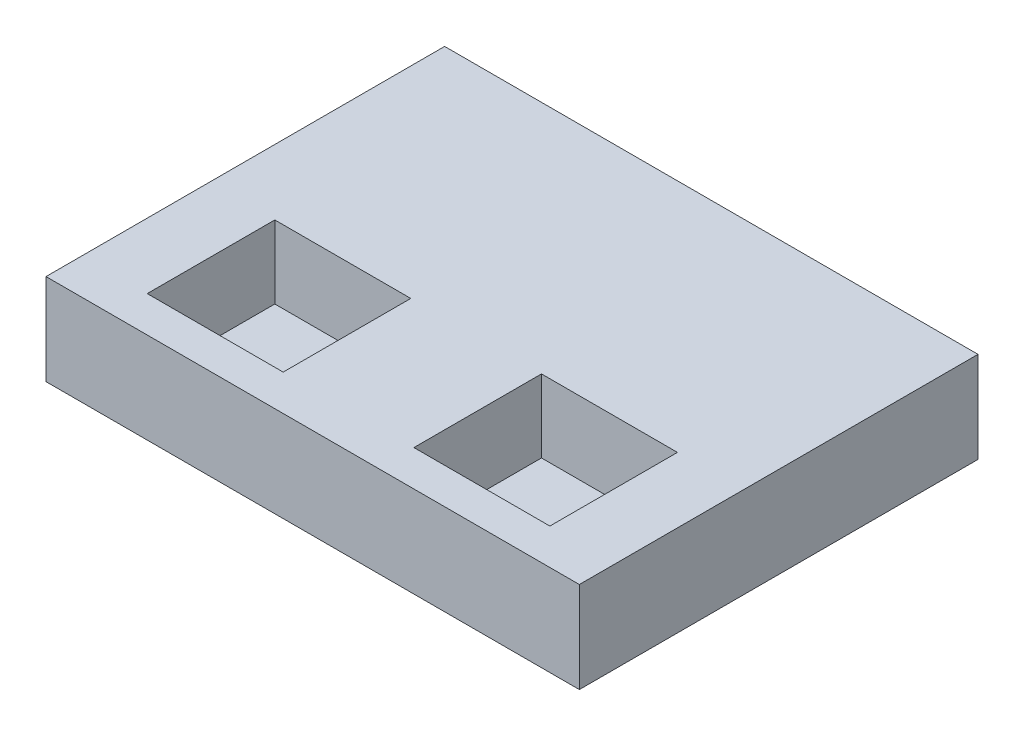
from build123d import *

# Parameters (mm, degrees)
SZKIC1_W                    = 293
SZKIC1_H                    = 219
DODANIE_WYCI_GNI_CIE1_DEPTH = 50
SZKIC2_W                    = 74.69112587
SZKIC2_H                    = 70.093493154
WYTNIJ_WYCI_GNI_CIE1_DEPTH  = 40


with BuildPart() as part:
    # Szkic1 → Dodanie-wyciągnięcie1 (new body)
    with BuildSketch(Plane(origin=(0, 0, 0), x_dir=(1, 0, 0), z_dir=(0, 1, 0))):
        Rectangle(SZKIC1_W, SZKIC1_H)
    extrude(amount=DODANIE_WYCI_GNI_CIE1_DEPTH)

    # Szkic2 → Wytnij-wyciągnięcie1 (cut)
    with BuildSketch(Plane(origin=(0, 50, 0), x_dir=(1, 0, 0), z_dir=(0, 1, 0))):
        with Locations((73.25, -54.75)):
            Rectangle(SZKIC2_W, SZKIC2_H)
        with Locations((-73.25, -54.75)):
            Rectangle(SZKIC2_W, SZKIC2_H)
    extrude(amount=-WYTNIJ_WYCI_GNI_CIE1_DEPTH, mode=Mode.SUBTRACT)


solid = part.part
